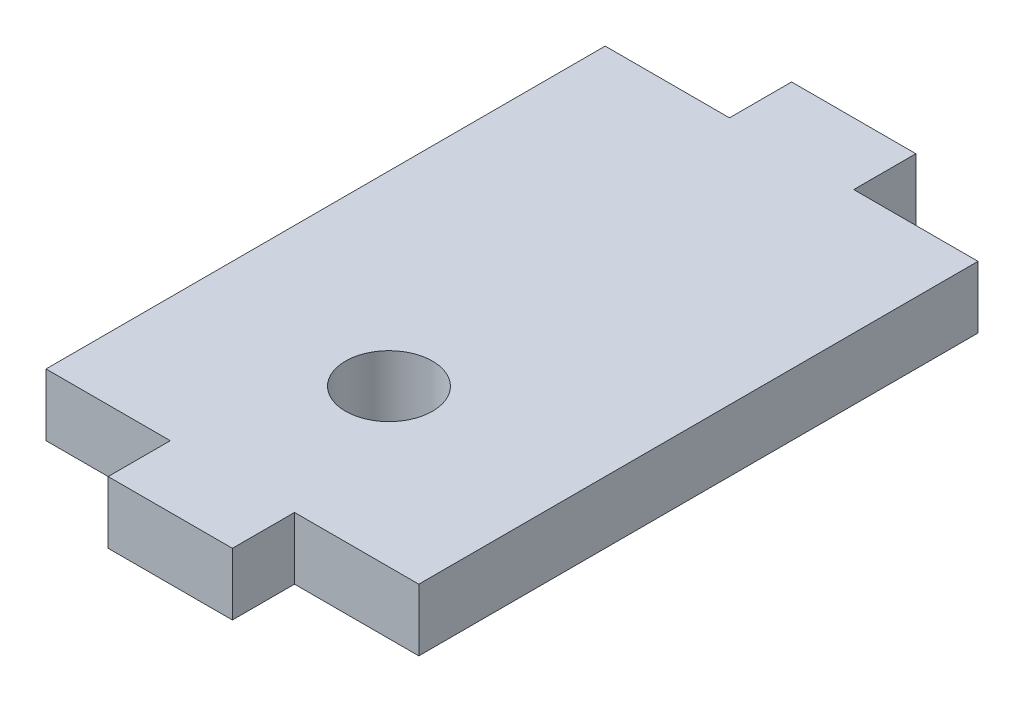
from build123d import *

# Parameters (mm, degrees)
SKETCH1_R           = 3.5
SKETCH1_W           = 10
SKETCH1_H           = 5
BOSS_EXTRUDE1_DEPTH = 5


with BuildPart() as part:
    # Sketch1 → Boss-Extrude1 (new body)
    # profile 1 of 3: a face of its own
    with BuildSketch(Plane(origin=(0, 0, 0), x_dir=(1, 0, 0), z_dir=(0, 1, 0))):
        Polygon((15, -22.5), (15, 22.5), (5, 22.5), (-5, 22.5), (-15, 22.5), (-15, -22.5), (-5, -22.5), (5, -22.5), align=None)
        with Locations(Location((0, -9.9, 0), (0, 0, 270))):
            Circle(SKETCH1_R, mode=Mode.SUBTRACT)
    # profile 2 of 3: a face of its own
    with BuildSketch(Plane(origin=(0, 0, 0), x_dir=(1, 0, 0), z_dir=(0, 1, 0))):
        with Locations((0, -25)):
            Rectangle(SKETCH1_W, SKETCH1_H)
    # profile 3 of 3: a face of its own
    with BuildSketch(Plane(origin=(0, 0, 0), x_dir=(1, 0, 0), z_dir=(0, 1, 0))):
        with Locations((0, 25)):
            Rectangle(SKETCH1_W, SKETCH1_H)
    extrude(amount=BOSS_EXTRUDE1_DEPTH)


solid = part.part
